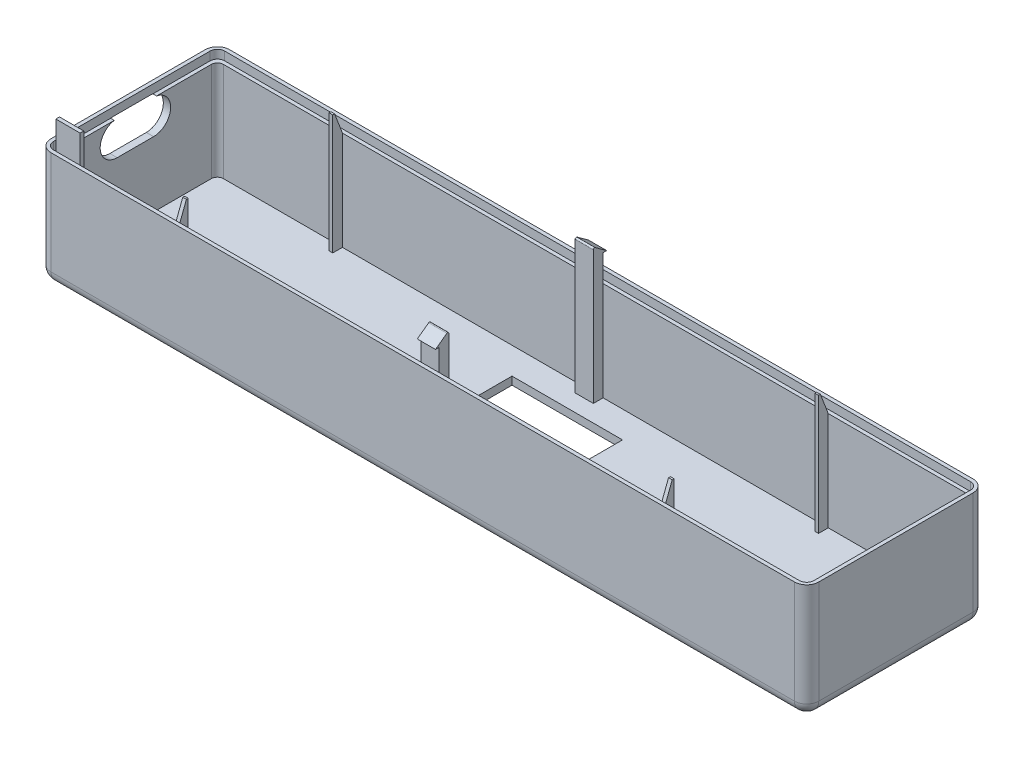
from build123d import *

# Parameters (mm, degrees)
SKETCH1_W            = 160.5788
SKETCH1_H            = 37.338
BOSS_EXTRUDE1_DEPTH  = 24.13
SKETCH2_W            = 157.5308
SKETCH2_H            = 34.29
CUT_EXTRUDE3_DEPTH   = 22.479
FILLET1_R            = 2.54
FILLET2_R            = 1.27
CUT_EXTRUDE4_REACH   = 165.451
SKETCH4_W            = 159.0548
SKETCH4_H            = 35.814
CUT_EXTRUDE5_DEPTH   = 1.778
FILLET3_R            = 1.524
SKETCH5_W            = 5.08
SKETCH5_H            = 0.762
BOSS_EXTRUDE2_DEPTH  = 7.62
SKETCH6_W            = 0.762
SKETCH6_H            = 2.032
BOSS_EXTRUDE3_DEPTH  = 25.019
LPATTERN1_COUNT      = 2
LPATTERN1_PITCH      = 101.6
LPATTERN1_COUNT_DIR2 = 2
LPATTERN1_PITCH_DIR2 = 32.258
CUT_EXTRUDE6_REACH   = 136.021
SKETCH8_W            = 3.81
SKETCH8_H            = 2.032
BOSS_EXTRUDE4_DEPTH  = 26.289
BOSS_EXTRUDE9_DEPTH  = 3.81
FILLET4_R            = 0.254
FILLET4_OF_MIRROR2_R = 0.254
SKETCH10_R           = 0.889
SKETCH10_W           = 23.114
SKETCH10_H           = 23.114
CUT_EXTRUDE7_DEPTH   = 88.711117296


with BuildPart() as part:
    # Sketch1 → Boss-Extrude1 (new body)
    with BuildSketch(Plane(origin=(0, 0, 0), x_dir=(1, 0, 0), z_dir=(0, 1, 0))):
        Rectangle(SKETCH1_W, SKETCH1_H)
    extrude(amount=BOSS_EXTRUDE1_DEPTH)

    # Sketch2 → Cut-Extrude3 (cut)
    with BuildSketch(Plane(origin=(0, 24.13, 0), x_dir=(1, 0, 0), z_dir=(0, 1, 0))):
        Rectangle(SKETCH2_W, SKETCH2_H)
    extrude(amount=-CUT_EXTRUDE3_DEPTH, mode=Mode.SUBTRACT)

    # Fillet1
    fillet1_edges = [part.edges().sort_by_distance(p)[0] for p in [
        (0, 0, 18.669),
        (-80.2894, 0, 0),
        (0, 0, -18.669),
        (80.2894, 0, 0),
        (80.2894, 12.065, 18.669),
        (-80.2894, 12.065, 18.669),
        (-80.2894, 12.065, -18.669),
        (80.2894, 12.065, -18.669),
    ]]
    fillet(fillet1_edges, radius=FILLET1_R)

    # Fillet2
    fillet2_edges = [part.edges().sort_by_distance(p)[0] for p in [
        (-78.7654, 12.8905, -17.145),
        (-78.7654, 12.8905, 17.145),
        (78.7654, 12.8905, 17.145),
        (78.7654, 12.8905, -17.145),
    ]]
    fillet(fillet2_edges, radius=FILLET2_R)

    # Sketch3 → Cut-Extrude4 (cut, up to next)
    with BuildSketch(Plane.ZY.offset(80.2894), mode=Mode.PRIVATE) as cut_extrude4_sk1:
        with BuildLine():
            Line((3.81, 15.2933146), (-3.81, 15.2933146))
            ThreePointArc((-3.81, 15.2933146), (-7.366, 18.8493146), (-3.81, 22.4053146))
            Line((-3.81, 22.4053146), (3.81, 22.4053146))
            ThreePointArc((3.81, 22.4053146), (7.366, 18.8493146), (3.81, 15.2933146))
        make_face()
    cut_extrude4_tool1 = extrude(cut_extrude4_sk1.sketch, amount=-CUT_EXTRUDE4_REACH, mode=Mode.PRIVATE) & part.part
    add(cut_extrude4_tool1.solids().sort_by_distance((-80.2894, 18.849315, 0))[0], mode=Mode.SUBTRACT)

    # Sketch4 → Cut-Extrude5 (cut)
    with BuildSketch(Plane(origin=(0, 24.13, 0), x_dir=(1, 0, 0), z_dir=(0, 1, 0))):
        Rectangle(SKETCH4_W, SKETCH4_H)
    extrude(amount=-CUT_EXTRUDE5_DEPTH, mode=Mode.SUBTRACT)

    # Fillet3
    fillet3_edges = [part.edges().sort_by_distance(p)[0] for p in [
        (-79.5274, 23.241, 17.907),
        (-79.5274, 23.241, -17.907),
        (79.5274, 23.241, -17.907),
        (79.5274, 23.241, 17.907),
    ]]
    fillet(fillet3_edges, radius=FILLET3_R)

    # Sketch5 → Boss-Extrude2 (add)
    with BuildSketch(Plane(origin=(0, 22.352, 0), x_dir=(1, 0, 0), z_dir=(0, 1, 0))):
        with Locations((-74.9554, -17.526)):
            Rectangle(SKETCH5_W, SKETCH5_H)
    extrude(amount=BOSS_EXTRUDE2_DEPTH)

    # Sketch6 → Boss-Extrude3 (add)
    with BuildSketch(Plane(origin=(0, 1.651, 0), x_dir=(1, 0, 0), z_dir=(0, 1, 0))):
        with Locations((-52.9844, 16.129)):
            Rectangle(SKETCH6_W, SKETCH6_H)
    boss_extrude3 = extrude(amount=BOSS_EXTRUDE3_DEPTH)

    # LPattern1: Boss-Extrude3 2 × 2
    with Locations(*[(i * LPATTERN1_PITCH, 0, j * LPATTERN1_PITCH_DIR2) for i in range(LPATTERN1_COUNT) for j in range(LPATTERN1_COUNT_DIR2) if (i, j) != (0, 0)]):
        add(boss_extrude3)

    # Cut-Extrude6: up to this face of the body (flat: up to its plane)
    cut_extrude6_end = Plane(part.part.faces().sort_by_distance((-53.3654, 14.1605, -16.129))[0])
    # Sketch7 → Cut-Extrude6 (cut, up to the picked face)
    with BuildSketch(Plane(origin=(48.9966, 0, 0), x_dir=(0, 0, -1), z_dir=(1, 0, 0)), mode=Mode.PRIVATE) as cut_extrude6_sk1:
        Polygon((17.145, 22.352), (15.494, 26.67), (17.145, 26.67), align=None)
    cut_extrude6_tool1 = split(extrude(cut_extrude6_sk1.sketch, amount=-CUT_EXTRUDE6_REACH, mode=Mode.PRIVATE), bisect_by=cut_extrude6_end, keep=Keep.BOTH, mode=Mode.PRIVATE)
    cut_extrude6 = cut_extrude6_tool1.solids().sort_by(Axis((48.9966, 25.230667, -16.594667), (-1, 0, 0)))[0]
    add(cut_extrude6, mode=Mode.SUBTRACT)

    # Mirror1: Cut-Extrude6 across plane
    add(cut_extrude6.mirror(Plane.XY), mode=Mode.SUBTRACT)

    # Sketch8 → Boss-Extrude4 (add)
    with BuildSketch(Plane(origin=(0, 1.651, 0), x_dir=(1, 0, 0), z_dir=(0, 1, 0))):
        with Locations((0, -16.129)):
            Rectangle(SKETCH8_W, SKETCH8_H)
        with Locations((0, 16.129)):
            Rectangle(SKETCH8_W, SKETCH8_H)
    extrude(amount=BOSS_EXTRUDE4_DEPTH)

    # Sketch9 → Boss-Extrude9 (add)
    with BuildSketch(Plane(origin=(1.905, 0, 0), x_dir=(0, 0, -1), z_dir=(1, 0, 0))):
        Polygon((-15.113, 27.94), (-17.907, 27.94), (-15.113, 29.972), align=None)
    boss_extrude9 = extrude(amount=-BOSS_EXTRUDE9_DEPTH)

    # Fillet4
    fillet4_edges = [part.edges().sort_by_distance(p)[0] for p in [
        (0, 29.972, 15.113),
    ]]
    fillet(fillet4_edges, radius=FILLET4_R)

    # Mirror2: Boss-Extrude9 across plane
    add(boss_extrude9.mirror(Plane.XY))

    # Fillet4 of Mirror2
    fillet4_of_mirror2_edges = [part.edges().sort_by_distance(p)[0] for p in [
        (0, 29.972, -15.113),
    ]]
    fillet(fillet4_of_mirror2_edges, radius=FILLET4_OF_MIRROR2_R)

    # Sketch10 → Cut-Extrude7 (cut, through all)
    with BuildSketch(Plane.XZ):
        with Locations(Location((-13.589, 0, 0), (0, 0, 270))):
            Circle(SKETCH10_R)
        with Locations(Location((13.589, 0, 0), (0, 0, 270))):
            Circle(SKETCH10_R)
        Rectangle(SKETCH10_W, SKETCH10_H)
    extrude(amount=-CUT_EXTRUDE7_DEPTH, mode=Mode.SUBTRACT)


solid = part.part
